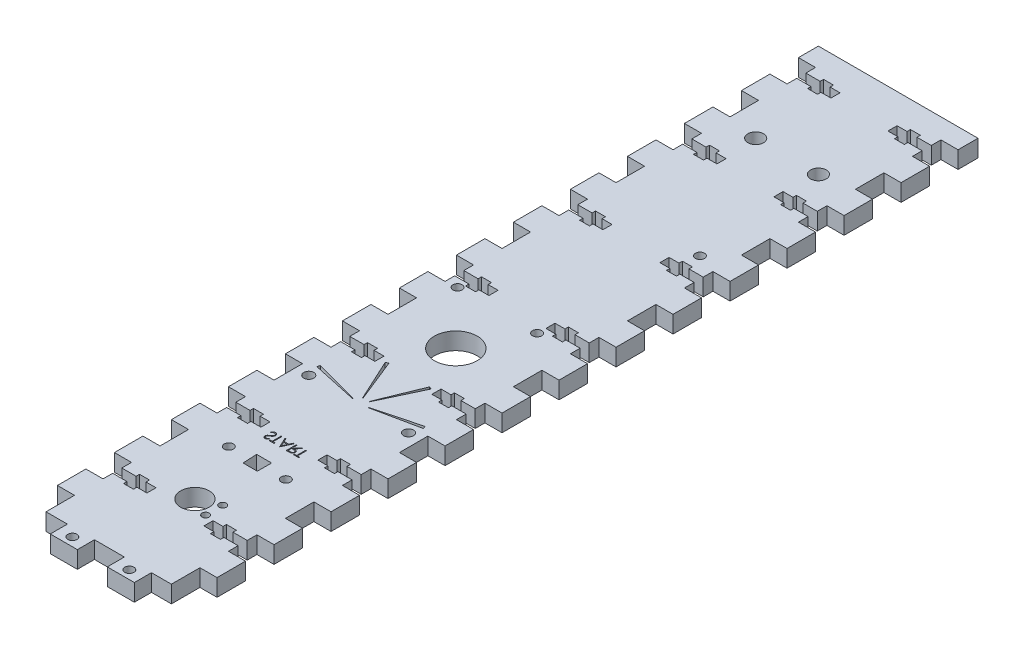
from build123d import *

# Parameters (mm, degrees)
SKETCH1_W                = 56
SKETCH1_H                = 6
BOSS_EXTRUDE1_DEPTH      = 277
SKETCH3_W                = 6
SKETCH3_H                = 10
CUT_EXTRUDE1_DEPTH       = 291.029245391
SKETCH6_W                = 9.5
SKETCH6_H                = 6
BOSS_EXTRUDE2_DEPTH      = 6
SKETCH9_W                = 3.2
SKETCH9_H                = 6
CUT_EXTRUDE2_DEPTH       = 12
SKETCH10_W               = 3.2
SKETCH10_H               = 6
CUT_EXTRUDE3_DEPTH       = 12
SKETCH11_W               = 3.5
SKETCH11_H               = 5.6
CUT_EXTRUDE4_DEPTH       = 12
SKETCH12_R               = 1.6
CUT_EXTRUDE5_DEPTH       = 12
SKETCH14_R               = 2.75
CUT_EXTRUDE6_DEPTH       = 296.765047262
SKETCH15_R               = 1.6
SKETCH15_R_2             = 7.5
CUT_EXTRUDE7_DEPTH       = 296.765047262
SKETCH16_R               = 1.25
SKETCH16_R_2             = 5
CUT_EXTRUDE8_DEPTH       = 296.765047262
SKETCH17_R               = 1.6
CUT_EXTRUDE9_DEPTH       = 10
CUT_EXTRUDE10_DEPTH      = 296.765047389
CUT_EXTRUDE10_DEPTH_BACK = 296.765047389
SKETCH18_R               = 1.75


with BuildPart() as part:
    # Sketch1 → Boss-Extrude1 (new body)
    with BuildSketch(Plane.XY):
        with Locations((-57.743589744, 27.128205128)):
            Rectangle(SKETCH1_W, SKETCH1_H)
    extrude(amount=BOSS_EXTRUDE1_DEPTH)

    # Sketch3 → Cut-Extrude1 (cut, through all)
    with BuildSketch(Plane(origin=(0, 30.128205128, 0), x_dir=(1, 0, 0), z_dir=(0, 1, 0))):
        with Locations((-82.743589744, -272)):
            Rectangle(SKETCH3_W, SKETCH3_H)
        with Locations((-32.743589744, -272)):
            Rectangle(SKETCH3_W, SKETCH3_H)
        with Locations((-82.743589744, -252)):
            Rectangle(SKETCH3_W, SKETCH3_H)
        with Locations((-32.743589744, -252)):
            Rectangle(SKETCH3_W, SKETCH3_H)
        with Locations((-82.743589744, -232)):
            Rectangle(SKETCH3_W, SKETCH3_H)
        with Locations((-32.743589744, -232)):
            Rectangle(SKETCH3_W, SKETCH3_H)
        with Locations((-82.743589744, -212)):
            Rectangle(SKETCH3_W, SKETCH3_H)
        with Locations((-32.743589744, -212)):
            Rectangle(SKETCH3_W, SKETCH3_H)
        with Locations((-82.743589744, -192)):
            Rectangle(SKETCH3_W, SKETCH3_H)
        with Locations((-32.743589744, -192)):
            Rectangle(SKETCH3_W, SKETCH3_H)
        with Locations((-82.743589744, -172)):
            Rectangle(SKETCH3_W, SKETCH3_H)
        with Locations((-32.743589744, -172)):
            Rectangle(SKETCH3_W, SKETCH3_H)
        with Locations((-82.743589744, -152)):
            Rectangle(SKETCH3_W, SKETCH3_H)
        with Locations((-32.743589744, -152)):
            Rectangle(SKETCH3_W, SKETCH3_H)
        with Locations((-82.743589744, -132)):
            Rectangle(SKETCH3_W, SKETCH3_H)
        with Locations((-32.743589744, -132)):
            Rectangle(SKETCH3_W, SKETCH3_H)
        with Locations((-82.743589744, -112)):
            Rectangle(SKETCH3_W, SKETCH3_H)
        with Locations((-32.743589744, -112)):
            Rectangle(SKETCH3_W, SKETCH3_H)
        with Locations((-82.743589744, -92)):
            Rectangle(SKETCH3_W, SKETCH3_H)
        with Locations((-32.743589744, -92)):
            Rectangle(SKETCH3_W, SKETCH3_H)
        with Locations((-82.743589744, -72)):
            Rectangle(SKETCH3_W, SKETCH3_H)
        with Locations((-32.743589744, -72)):
            Rectangle(SKETCH3_W, SKETCH3_H)
        with Locations((-82.743589744, -52)):
            Rectangle(SKETCH3_W, SKETCH3_H)
        with Locations((-32.743589744, -52)):
            Rectangle(SKETCH3_W, SKETCH3_H)
        with Locations((-82.743589744, -32)):
            Rectangle(SKETCH3_W, SKETCH3_H)
        with Locations((-32.743589744, -32)):
            Rectangle(SKETCH3_W, SKETCH3_H)
        with Locations((-82.743589744, -12)):
            Rectangle(SKETCH3_W, SKETCH3_H)
        with Locations((-32.743589744, -12)):
            Rectangle(SKETCH3_W, SKETCH3_H)
    extrude(amount=-CUT_EXTRUDE1_DEPTH, mode=Mode.SUBTRACT)

    # Sketch6 → Boss-Extrude2 (add)
    with BuildSketch(Plane.XY.offset(277)):
        with Locations((-67.493589744, 27.128205128)):
            Rectangle(SKETCH6_W, SKETCH6_H)
        with Locations((-47.493589744, 27.128205128)):
            Rectangle(SKETCH6_W, SKETCH6_H)
    extrude(amount=BOSS_EXTRUDE2_DEPTH)

    # Sketch9 → Cut-Extrude2 (cut)
    with BuildSketch(Plane(origin=(-35.743589744, 0, 0), x_dir=(0, 0, -1), z_dir=(1, 0, 0))):
        with Locations((-252, 27.128205128)):
            Rectangle(SKETCH9_W, SKETCH9_H)
        with Locations((-212, 27.128205128)):
            Rectangle(SKETCH9_W, SKETCH9_H)
        with Locations((-172, 27.128205128)):
            Rectangle(SKETCH9_W, SKETCH9_H)
        with Locations((-132, 27.128205128)):
            Rectangle(SKETCH9_W, SKETCH9_H)
        with Locations((-92, 27.128205128)):
            Rectangle(SKETCH9_W, SKETCH9_H)
        with Locations((-52, 27.128205128)):
            Rectangle(SKETCH9_W, SKETCH9_H)
        with Locations((-12, 27.128205128)):
            Rectangle(SKETCH9_W, SKETCH9_H)
    extrude(amount=-CUT_EXTRUDE2_DEPTH, mode=Mode.SUBTRACT)

    # Sketch10 → Cut-Extrude3 (cut)
    with BuildSketch(Plane.ZY.offset(79.743589744)):
        with Locations((252, 27.128205128)):
            Rectangle(SKETCH10_W, SKETCH10_H)
        with Locations((212, 27.128205128)):
            Rectangle(SKETCH10_W, SKETCH10_H)
        with Locations((172, 27.128205128)):
            Rectangle(SKETCH10_W, SKETCH10_H)
        with Locations((132, 27.128205128)):
            Rectangle(SKETCH10_W, SKETCH10_H)
        with Locations((92, 27.128205128)):
            Rectangle(SKETCH10_W, SKETCH10_H)
        with Locations((52, 27.128205128)):
            Rectangle(SKETCH10_W, SKETCH10_H)
        with Locations((12, 27.128205128)):
            Rectangle(SKETCH10_W, SKETCH10_H)
    extrude(amount=-CUT_EXTRUDE3_DEPTH, mode=Mode.SUBTRACT)

    # Sketch11 → Cut-Extrude4 (cut)
    with BuildSketch(Plane.XZ.offset(-24.128205128)):
        with Locations((-72.993589744, 252)):
            Rectangle(SKETCH11_W, SKETCH11_H)
        with Locations((-42.493589744, 252)):
            Rectangle(SKETCH11_W, SKETCH11_H)
        with Locations((-72.993589744, 212)):
            Rectangle(SKETCH11_W, SKETCH11_H)
        with Locations((-42.493589744, 212)):
            Rectangle(SKETCH11_W, SKETCH11_H)
        with Locations((-72.993589744, 172)):
            Rectangle(SKETCH11_W, SKETCH11_H)
        with Locations((-42.493589744, 172)):
            Rectangle(SKETCH11_W, SKETCH11_H)
        with Locations((-72.993589744, 132)):
            Rectangle(SKETCH11_W, SKETCH11_H)
        with Locations((-42.493589744, 132)):
            Rectangle(SKETCH11_W, SKETCH11_H)
        with Locations((-72.993589744, 92)):
            Rectangle(SKETCH11_W, SKETCH11_H)
        with Locations((-42.493589744, 92)):
            Rectangle(SKETCH11_W, SKETCH11_H)
        with Locations((-72.993589744, 52)):
            Rectangle(SKETCH11_W, SKETCH11_H)
        with Locations((-42.493589744, 52)):
            Rectangle(SKETCH11_W, SKETCH11_H)
        with Locations((-72.993589744, 12)):
            Rectangle(SKETCH11_W, SKETCH11_H)
        with Locations((-42.493589744, 12)):
            Rectangle(SKETCH11_W, SKETCH11_H)
    extrude(amount=-CUT_EXTRUDE4_DEPTH, mode=Mode.SUBTRACT)

    # Sketch12 → Cut-Extrude5 (cut)
    with BuildSketch(Plane.XZ.offset(-24.128205128)):
        with Locations(Location((-67.493589744, 280, 0), (0, 0, 270))):
            Circle(SKETCH12_R)
        with Locations(Location((-47.493589744, 280, 0), (0, 0, 270))):
            Circle(SKETCH12_R)
    extrude(amount=-CUT_EXTRUDE5_DEPTH, mode=Mode.SUBTRACT)

    # Sketch14 → Cut-Extrude6 (cut, through all)
    with BuildSketch(Plane.XZ.offset(-24.128205128)):
        with Locations(Location((-68.743589744, 39, 0), (0, 0, 270))):
            Circle(SKETCH14_R)
        with Locations(Location((-46.743589744, 39, 0), (0, 0, 90))):
            Circle(SKETCH14_R)
    extrude(amount=-CUT_EXTRUDE6_DEPTH, mode=Mode.SUBTRACT)

    # Sketch15 → Cut-Extrude7 (cut, through all)
    with BuildSketch(Plane.XZ.offset(-24.128205128)):
        with Locations(Location((-75.743589744, 136.6, 0), (0, 0, 270))):
            Circle(SKETCH15_R)
        with Locations(Location((-47.843589744, 136.6, 0), (0, 0, 270))):
            Circle(SKETCH15_R)
        with Locations(Location((-42.793589744, 84.5, 0), (0, 0, 270))):
            Circle(SKETCH15_R)
        with Locations(Location((-57.493589744, 155.461682015, 0), (0, 0, 270))):
            Circle(SKETCH15_R_2)
    extrude(amount=-CUT_EXTRUDE7_DEPTH, mode=Mode.SUBTRACT)

    # Sketch16 → Cut-Extrude8 (cut, through all)
    with BuildSketch(Plane.XZ.offset(-24.128205128)):
        with Locations(Location((-50.743589744, 250, 0), (0, 0, 270))):
            Circle(SKETCH16_R)
        with Locations(Location((-50.743589744, 244, 0), (0, 0, 270))):
            Circle(SKETCH16_R)
        with Locations(Location((-57.493589744, 247, 0), (0, 0, 270))):
            Circle(SKETCH16_R_2)
    extrude(amount=-CUT_EXTRUDE8_DEPTH, mode=Mode.SUBTRACT)

    # Sketch17 → Cut-Extrude9 (cut)
    # profile 1 of 8: a face of its own
    with BuildSketch(Plane.XZ.offset(-24.128205128)):
        with Locations(Location((-67.493589744, 225.103941312, 0), (0, 0, 270))):
            Circle(SKETCH17_R)
    # profile 2 of 8: a face of its own
    with BuildSketch(Plane.XZ.offset(-24.128205128)):
        with Locations(Location((-47.493589744, 225.103941312, 0), (0, 0, 270))):
            Circle(SKETCH17_R)
    # profile 3 of 8: a face of its own
    with BuildSketch(Plane.XZ.offset(-24.128205128)):
        Polygon((-59.993589744, 227.603941312), (-54.993589744, 227.603941312), (-54.993589744, 222.603941312), (-60.243589744, 222.603941312), align=None)
    # profile 4 of 8: a face of its own
    with BuildSketch(Plane.XZ.offset(-24.128205128)):
        with BuildLine():
            Line((-64.653846154, 213.420253416), (-64.357972756, 213.59763723))
            add(Edge.make_bspline(
                [(-64.357972756, 213.59763723), (-64.330454519, 213.551572845), (-64.277730639, 213.463315261), (-64.189779279, 213.344057221), (-64.098646368, 213.242695064), (-64.003657035, 213.159818456), (-63.905391087, 213.09456957), (-63.803207033, 213.048367338), (-63.697449222, 213.019551363), (-63.625475401, 213.016051276), (-63.589543269, 213.014303897)],
                knots=[0, 0, 0, 0, 1.272034388, 2.437168799, 3.508375237, 4.49857839, 5.41946034, 6.295179144, 7.148887113, 8, 8, 8, 8], degree=3))
            add(Edge.make_bspline(
                [(-63.589543269, 213.014303897), (-63.558856409, 213.015158569), (-63.498019636, 213.016852959), (-63.408457393, 213.033133762), (-63.32147559, 213.05814589), (-63.238866953, 213.093966822), (-63.161771338, 213.137305308), (-63.094164643, 213.189651485), (-63.03571853, 213.248257691), (-62.987909415, 213.313640346), (-62.95122938, 213.383957494), (-62.923037311, 213.456133445), (-62.907392238, 213.531302014), (-62.905035484, 213.581912477), (-62.903846154, 213.607452935)],
                knots=[0, 0, 0, 0, 1.095163259, 2.171163733, 3.241058638, 4.321873601, 5.38011039, 6.391990106, 7.366004449, 8.327778327, 9.272591725, 10.192022065, 11.087607919, 12, 12, 12, 12], degree=3))
            add(Edge.make_bspline(
                [(-62.903846154, 213.607452935), (-62.905320465, 213.636593785), (-62.908317523, 213.695832874), (-62.933649003, 213.783232527), (-62.97349825, 213.869725097), (-63.010260893, 213.923226363), (-63.029346955, 213.951002615)],
                knots=[0, 0, 0, 0, 0.938893495, 1.908633276, 2.914225137, 4, 4, 4, 4], degree=3))
            add(Edge.make_bspline(
                [(-63.029346955, 213.951002615), (-63.045017569, 213.971049438), (-63.077916064, 214.013135237), (-63.134473576, 214.075780472), (-63.20083969, 214.140398891), (-63.274743245, 214.209457948), (-63.358876334, 214.279745745), (-63.450603849, 214.354614023), (-63.552267708, 214.4312156), (-63.623567204, 214.482588165), (-63.660356571, 214.509095563)],
                knots=[0, 0, 0, 0, 0.722233717, 1.516239348, 2.393582979, 3.351407094, 4.387010283, 5.505090956, 6.712668013, 8, 8, 8, 8], degree=3))
            add(Edge.make_bspline(
                [(-63.660356571, 214.509095563), (-63.697180567, 214.535324151), (-63.767585243, 214.585471213), (-63.866043826, 214.659895497), (-63.954088289, 214.727939367), (-64.031327305, 214.790243379), (-64.097726902, 214.846815984), (-64.153810313, 214.897113923), (-64.19814887, 214.942497484), (-64.222804451, 214.971938825), (-64.233874199, 214.985157262)],
                knots=[0, 0, 0, 0, 1.452282411, 2.77665338, 3.964542531, 5.026858415, 5.96415736, 6.766646006, 7.446254459, 8, 8, 8, 8], degree=3))
            add(Edge.make_bspline(
                [(-64.233874199, 214.985157262), (-64.249346744, 215.005758299), (-64.279775581, 215.046273003), (-64.319941586, 215.10959786), (-64.354080749, 215.174421126), (-64.380843081, 215.24091699), (-64.4033793, 215.308151919), (-64.418537231, 215.377003165), (-64.428028628, 215.447161784), (-64.429000614, 215.494375284), (-64.429487179, 215.518009826)],
                knots=[0, 0, 0, 0, 1.068054152, 2.10047183, 3.106115577, 4.101338837, 5.06977816, 6.043150881, 7.020423561, 8, 8, 8, 8], degree=3))
            add(Edge.make_bspline(
                [(-64.429487179, 215.518009826), (-64.42818197, 215.555039601), (-64.42559945, 215.628307664), (-64.403758933, 215.735338495), (-64.36928604, 215.837524912), (-64.320991152, 215.933855246), (-64.258733799, 216.021821227), (-64.186687824, 216.102434714), (-64.100876338, 216.170203296), (-64.006723715, 216.229415354), (-63.903667343, 216.27576128), (-63.795676439, 216.31072226), (-63.682579367, 216.330531517), (-63.605976233, 216.333374282), (-63.567107372, 216.334816717)],
                knots=[0, 0, 0, 0, 1.005424448, 1.989358655, 2.955360095, 3.929531133, 4.905563448, 5.876582895, 6.856512386, 7.866279853, 8.892233794, 9.918561126, 10.94386622, 12, 12, 12, 12], degree=3))
            add(Edge.make_bspline(
                [(-63.567107372, 216.334816717), (-63.525863271, 216.333394166), (-63.44384192, 216.330565165), (-63.323192704, 216.305967633), (-63.207031988, 216.265266961), (-63.113588723, 216.219078303), (-63.040455961, 216.172946888), (-62.984683229, 216.130927063), (-62.928165778, 216.082551955), (-62.870447723, 216.027692709), (-62.812507064, 215.965845958), (-62.753483612, 215.897435269), (-62.693239343, 215.822878713), (-62.654483483, 215.769654212), (-62.634615385, 215.742368801)],
                knots=[0, 0, 0, 0, 1.286793592, 2.559021753, 3.825965368, 5.121522368, 5.803751409, 6.523245864, 7.299691795, 8.125521123, 9.008227632, 9.944561021, 10.946284179, 12, 12, 12, 12], degree=3))
            Line((-62.634615385, 215.742368801), (-62.918569712, 215.52712441))
            add(Edge.make_bspline(
                [(-62.918569712, 215.52712441), (-62.935715644, 215.5492131), (-62.968734701, 215.591750753), (-63.018864188, 215.651322069), (-63.066112836, 215.705738548), (-63.112663236, 215.753003676), (-63.156056867, 215.79570581), (-63.198173909, 215.832265567), (-63.238408261, 215.863041162), (-63.289125171, 215.895884722), (-63.35284289, 215.928441225), (-63.432827426, 215.955990304), (-63.516413701, 215.972545365), (-63.573343332, 215.974734253), (-63.602163462, 215.975842358)],
                knots=[0, 0, 0, 0, 1.181633172, 2.275549214, 3.290209073, 4.226197932, 5.078386478, 5.862611352, 6.581680152, 7.217281963, 8.414376989, 9.595101626, 10.782541182, 12, 12, 12, 12], degree=3))
            add(Edge.make_bspline(
                [(-63.602163462, 215.975842358), (-63.638319984, 215.974630658), (-63.708044431, 215.972294009), (-63.807034667, 215.946774024), (-63.896128593, 215.906592163), (-63.972681158, 215.850277185), (-64.036418135, 215.783556193), (-64.082523593, 215.706777338), (-64.110273758, 215.621994935), (-64.113660038, 215.562853279), (-64.115384615, 215.532733384)],
                knots=[0, 0, 0, 0, 1.14458467, 2.207223713, 3.21896685, 4.227309161, 5.202851033, 6.127160689, 7.046193047, 8, 8, 8, 8], degree=3))
            add(Edge.make_bspline(
                [(-64.115384615, 215.532733384), (-64.114991489, 215.513981905), (-64.114204593, 215.476448286), (-64.103229795, 215.420996864), (-64.089130466, 215.365685525), (-64.066787834, 215.310762942), (-64.035942531, 215.255268583), (-63.995437355, 215.198246845), (-63.944424043, 215.139195136), (-63.90534703, 215.100787763), (-63.884715545, 215.080509826)],
                knots=[0, 0, 0, 0, 0.858281714, 1.717966888, 2.583508476, 3.4729293, 4.427298488, 5.488583878, 6.674047936, 8, 8, 8, 8], degree=3))
            add(Edge.make_bspline(
                [(-63.884715545, 215.080509826), (-63.877054172, 215.0736728), (-63.858852505, 215.057429592), (-63.82557658, 215.030837311), (-63.781633781, 214.998034539), (-63.72817158, 214.957447223), (-63.664204218, 214.910365761), (-63.589724662, 214.857392148), (-63.505563129, 214.796806689), (-63.445841214, 214.754449149), (-63.414262821, 214.732052294)],
                knots=[0, 0, 0, 0, 0.420754252, 0.999615792, 1.744751191, 2.668019286, 3.750313428, 4.999500688, 6.413464383, 8, 8, 8, 8], degree=3))
            add(Edge.make_bspline(
                [(-63.414262821, 214.732052294), (-63.376276907, 214.704410935), (-63.302722451, 214.650887273), (-63.198064871, 214.570471593), (-63.103171063, 214.491823824), (-63.017707859, 214.415446217), (-62.940830951, 214.341918124), (-62.87339323, 214.270354944), (-62.81470755, 214.201269371), (-62.751528331, 214.112696795), (-62.686970512, 214.003915711), (-62.631529004, 213.870637473), (-62.596570657, 213.736841152), (-62.591999141, 213.646914316), (-62.58974359, 213.602545083)],
                knots=[0, 0, 0, 0, 1.163667725, 2.253281268, 3.268753668, 4.215851969, 5.092017293, 5.902905408, 6.650798638, 7.335211899, 8.59617414, 9.77448103, 10.901945474, 12, 12, 12, 12], degree=3))
            add(Edge.make_bspline(
                [(-62.58974359, 213.602545083), (-62.590400728, 213.571166718), (-62.591702243, 213.509019334), (-62.606663157, 213.417764257), (-62.628582822, 213.329133387), (-62.661620056, 213.244222275), (-62.701943214, 213.161477512), (-62.753109462, 213.083069612), (-62.812417147, 213.007263213), (-62.880450912, 212.936079722), (-62.954896814, 212.870733526), (-63.033580509, 212.812604464), (-63.116630782, 212.764136141), (-63.203597098, 212.724585299), (-63.294499435, 212.693651781), (-63.389307219, 212.671238912), (-63.48817673, 212.657483201), (-63.555377212, 212.65605544), (-63.589543269, 212.655329538)],
                knots=[0, 0, 0, 0, 0.983748083, 1.948392443, 2.894712957, 3.844097841, 4.80183111, 5.778335162, 6.776009319, 7.81870978, 8.863265674, 9.881300176, 10.883814829, 11.87499822, 12.874611388, 13.892143829, 14.928324115, 16, 16, 16, 16], degree=3))
            add(Edge.make_bspline(
                [(-63.589543269, 212.655329538), (-63.615978612, 212.655840719), (-63.668516372, 212.656856645), (-63.746225854, 212.665837925), (-63.822365443, 212.678545029), (-63.895979725, 212.698719099), (-63.968017137, 212.723196076), (-64.038164372, 212.753334408), (-64.106455425, 212.78945161), (-64.173273008, 212.830746634), (-64.238447183, 212.878804379), (-64.301366651, 212.934777875), (-64.364095836, 212.99712338), (-64.424783233, 213.067533944), (-64.484656377, 213.144872027), (-64.542534786, 213.22986121), (-64.599616504, 213.322038564), (-64.635431972, 213.38690365), (-64.653846154, 213.420253416)],
                knots=[0, 0, 0, 0, 0.915332311, 1.819136955, 2.706846663, 3.586547465, 4.459518054, 5.340707479, 6.227863349, 7.133153174, 8.059268498, 9.028702269, 10.047606654, 11.120612155, 12.245963614, 13.433783089, 14.680604001, 16, 16, 16, 16], degree=3))
        make_face()
    # profile 5 of 8: a face of its own
    with BuildSketch(Plane.XZ.offset(-24.128205128)):
        Polygon((-62.275641026, 215.886098769), (-62.275641026, 216.245073127), (-60.435897436, 216.245073127), (-60.435897436, 215.886098769), (-61.198717949, 215.886098769), (-61.198717949, 212.745073127), (-61.512820513, 212.745073127), (-61.512820513, 215.886098769), align=None)
    # profile 6 of 8: a face of its own
    with BuildSketch(Plane.XZ.offset(-24.128205128)):
        Polygon((-58.461538462, 216.245073127), (-56.846153846, 212.745073127), (-57.18760016, 212.745073127), (-57.705028045, 213.866867999), (-59.291666667, 213.866867999), (-59.823818109, 212.745073127), (-60.166666667, 212.745073127), (-58.506410256, 216.245073127), align=None)
        Polygon((-58.487479968, 215.562881621), (-59.121294071, 214.225842358), (-57.870492788, 214.225842358), align=None, mode=Mode.SUBTRACT)
    # profile 7 of 8: a face of its own
    with BuildSketch(Plane.XZ.offset(-24.128205128)):
        with BuildLine():
            Line((-56.217948718, 216.245073127), (-55.517528045, 216.245073127))
            add(Edge.make_bspline(
                [(-55.517528045, 216.245073127), (-55.470786916, 216.244917541), (-55.381038772, 216.244618799), (-55.252465502, 216.242953036), (-55.135638405, 216.238178681), (-55.030618565, 216.234070097), (-54.93740791, 216.226578156), (-54.85572062, 216.219417509), (-54.785932922, 216.210043848), (-54.743687071, 216.201338425), (-54.724559295, 216.197396845)],
                knots=[0, 0, 0, 0, 1.410062039, 2.707475311, 3.878576406, 4.937260626, 5.877586885, 6.699081471, 7.410979367, 8, 8, 8, 8], degree=3))
            add(Edge.make_bspline(
                [(-54.724559295, 216.197396845), (-54.698952671, 216.19107008), (-54.648285681, 216.178551516), (-54.575335615, 216.152091916), (-54.505821291, 216.121472291), (-54.440031467, 216.085508571), (-54.378295676, 216.043933791), (-54.319977365, 215.997465669), (-54.264811902, 215.946358463), (-54.215030271, 215.889323621), (-54.16809122, 215.829487112), (-54.128502593, 215.764783355), (-54.094376113, 215.697121827), (-54.067205596, 215.625814409), (-54.045327623, 215.551552638), (-54.029901384, 215.473663841), (-54.020650196, 215.392502866), (-54.01970834, 215.337144957), (-54.019230769, 215.309075531)],
                knots=[0, 0, 0, 0, 1.027469482, 2.033020251, 3.019912614, 3.986113645, 4.951240523, 5.91722682, 6.890402269, 7.87763091, 8.8651537, 9.85103654, 10.82876324, 11.815024772, 12.821070561, 13.842952187, 14.906261191, 16, 16, 16, 16], degree=3))
            add(Edge.make_bspline(
                [(-54.019230769, 215.309075531), (-54.020699767, 215.262440427), (-54.023566163, 215.171443259), (-54.050291267, 215.039382377), (-54.094067787, 214.916193063), (-54.154391076, 214.802030425), (-54.231210551, 214.69911978), (-54.323535342, 214.608729324), (-54.431416954, 214.533089412), (-54.53184627, 214.480636607), (-54.620560469, 214.447043698), (-54.693593782, 214.423407339), (-54.77326076, 214.405145374), (-54.858798094, 214.388785242), (-54.95056175, 214.376433548), (-55.048331789, 214.367386953), (-55.152177941, 214.361732905), (-55.22351701, 214.3608909), (-55.260216346, 214.360457743)],
                knots=[0, 0, 0, 0, 1.260483769, 2.459530307, 3.627416485, 4.787058657, 5.939039949, 7.08810263, 8.267026773, 9.491475466, 10.141966685, 10.831826277, 11.566392101, 12.351337768, 13.187381173, 14.07005841, 15.007169909, 16, 16, 16, 16], degree=3))
            Line((-55.260216346, 214.360457743), (-53.974358974, 212.745073127))
            Line((-53.974358974, 212.745073127), (-54.362780449, 212.745073127))
            Line((-54.362780449, 212.745073127), (-55.648637821, 214.360457743))
            Line((-55.648637821, 214.360457743), (-55.903846154, 214.360457743))
            Line((-55.903846154, 214.360457743), (-55.903846154, 212.745073127))
            Line((-55.903846154, 212.745073127), (-56.217948718, 212.745073127))
            Line((-56.217948718, 212.745073127), (-56.217948718, 216.245073127))
        make_face()
        with BuildLine():
            Line((-55.903846154, 215.886098769), (-55.903846154, 214.719432102))
            Line((-55.903846154, 214.719432102), (-55.263020833, 214.714524249))
            add(Edge.make_bspline(
                [(-55.263020833, 214.714524249), (-55.233100794, 214.714511013), (-55.175107237, 214.714485356), (-55.091206572, 214.718479132), (-55.013086461, 214.723022451), (-54.941045709, 214.729971796), (-54.875052133, 214.738927868), (-54.81513872, 214.750130852), (-54.761207668, 214.763182915), (-54.69830913, 214.783384541), (-54.628072598, 214.815390559), (-54.551741139, 214.861956058), (-54.486738801, 214.920525177), (-54.431820938, 214.987498633), (-54.387691507, 215.061134882), (-54.356579453, 215.140551251), (-54.33683701, 215.223742849), (-54.334508465, 215.280920957), (-54.333333333, 215.309776653)],
                knots=[0, 0, 0, 0, 1.146690395, 2.22261258, 3.21895312, 4.145990853, 4.996080663, 5.770904154, 6.481378293, 7.121626537, 8.300444488, 9.431385265, 10.535395872, 11.636531494, 12.74115979, 13.810798291, 14.895190096, 16, 16, 16, 16], degree=3))
            add(Edge.make_bspline(
                [(-54.333333333, 215.309776653), (-54.334535454, 215.337923227), (-54.33691762, 215.393699466), (-54.356366388, 215.475355376), (-54.38925577, 215.552422326), (-54.433578008, 215.624586811), (-54.487577163, 215.690092547), (-54.550894975, 215.7461397), (-54.62180017, 215.792389165), (-54.688071369, 215.821943545), (-54.747305581, 215.840063398), (-54.798735241, 215.852814562), (-54.856846719, 215.863059031), (-54.921922178, 215.871267092), (-54.993683808, 215.878322036), (-55.072494459, 215.883073815), (-55.15783124, 215.885887679), (-55.216978171, 215.886026768), (-55.247596154, 215.886098769)],
                knots=[0, 0, 0, 0, 1.101028733, 2.181837193, 3.264309656, 4.369019818, 5.486613113, 6.575447106, 7.666700264, 8.788928104, 9.402425223, 10.0903467, 10.862060571, 11.710948788, 12.657782767, 13.684531032, 14.801375019, 16, 16, 16, 16], degree=3))
            Line((-55.247596154, 215.886098769), (-55.903846154, 215.886098769))
        make_face(mode=Mode.SUBTRACT)
    # profile 8 of 8: a face of its own
    with BuildSketch(Plane.XZ.offset(-24.128205128)):
        Polygon((-53.66025641, 215.886098769), (-53.66025641, 216.245073127), (-51.820512821, 216.245073127), (-51.820512821, 215.886098769), (-52.583333333, 215.886098769), (-52.583333333, 212.745073127), (-52.897435897, 212.745073127), (-52.897435897, 215.886098769), align=None)
    extrude(amount=-CUT_EXTRUDE9_DEPTH, mode=Mode.SUBTRACT)


with BuildPart() as cut_extrude9_piece_1:
    # of the separate pieces the step leaves, piece 1, a body of its own (cut_extrude9_pieces)
    add(part.part.solids().sort_by_distance((-85.743589744, 30.128205128, 0))[0])

    # Sketch18 → Cut-Extrude10 (cut, two sides: drawn at the far end of the back side and taken through both)
    with BuildSketch(Plane.XZ.offset(-24.128205128).offset(-CUT_EXTRUDE10_DEPTH_BACK)):
        with BuildLine():
            ThreePointArc((-58.680138596, 186.778406771), (-58.749230741, 186.807111094), (-58.817547625, 186.837614637))
            Line((-58.817547625, 186.837614637), (-65.631823148, 172.09759214))
            Line((-65.631823148, 172.09759214), (-64.713450082, 171.701876447))
            Line((-64.713450082, 171.701876447), (-58.680138596, 186.778406771))
        make_face()
        with BuildLine():
            Line((-49.491165999, 172.150839971), (-56.402546448, 186.845581696))
            ThreePointArc((-56.402546448, 186.845581696), (-56.470660585, 186.814628069), (-56.539561839, 186.785468507))
            Line((-56.539561839, 186.785468507), (-50.406908182, 171.749073553))
            Line((-50.406908182, 171.749073553), (-49.491165999, 172.150839971))
        make_face()
        with BuildLine():
            ThreePointArc((-54.821900648, 188.84615348), (-54.8381574, 188.773202178), (-54.856316736, 188.700701055))
            Line((-54.856316736, 188.700701055), (-39.156941775, 184.549527734))
            Line((-39.156941775, 184.549527734), (-38.901310698, 185.51630214))
            Line((-38.901310698, 185.51630214), (-54.821900648, 188.84615348))
        make_face()
        with BuildLine():
            Line((-76.047627781, 184.427825813), (-60.375983581, 188.682491742))
            ThreePointArc((-60.375983581, 188.682491742), (-60.394620877, 188.754871473), (-60.4113586, 188.827713926))
            Line((-60.4113586, 188.827713926), (-76.309631978, 185.392892547))
            Line((-76.309631978, 185.392892547), (-76.047627781, 184.427825813))
        make_face()
        with Locations(Location((-75.118589744, 189.431091535, 0), (0, 0, 270))):
            Circle(SKETCH18_R)
        with Locations(Location((-40.118589744, 189.431091535, 0), (0, 0, 270))):
            Circle(SKETCH18_R)
    extrude(amount=CUT_EXTRUDE10_DEPTH + CUT_EXTRUDE10_DEPTH_BACK, mode=Mode.SUBTRACT)


with BuildPart() as cut_extrude9_piece_2:
    # of the separate pieces the step leaves, piece 2, a body of its own (cut_extrude9_pieces)
    add(part.part.solids().sort_by_distance((-55.263020833, 30.128205128, 214.714524249))[0])


with BuildPart() as cut_extrude9_piece_3:
    # of the separate pieces the step leaves, piece 3, a body of its own (cut_extrude9_pieces)
    add(part.part.solids().sort_by_distance((-57.870492788, 30.128205128, 214.225842358))[0])


solid = Compound([cut_extrude9_piece_1.part, cut_extrude9_piece_2.part, cut_extrude9_piece_3.part])
